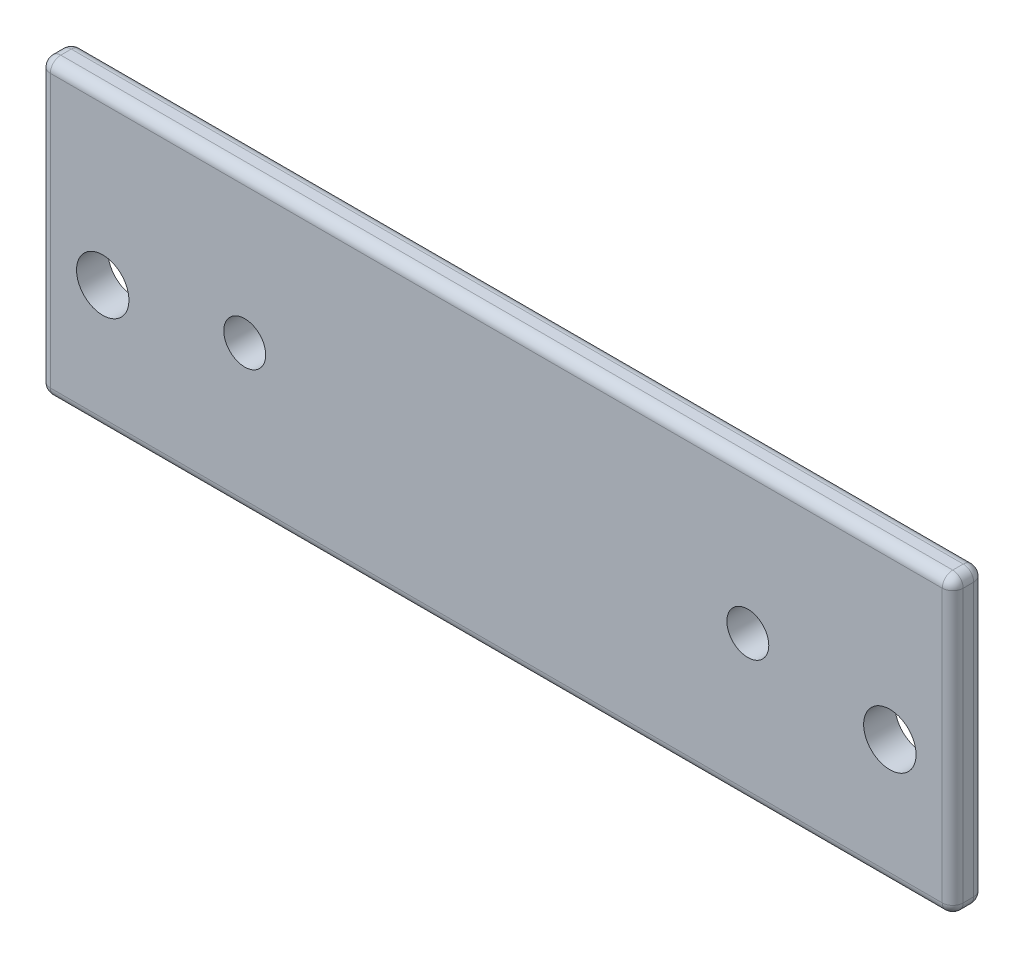
from build123d import *

# Parameters (mm, degrees)
AUFSATZ_LINEAR_AUSTRAGEN1_DEPTH = 3
SKIZZE3_R                       = 2.5
SCHNITT_LINEAR_AUSTRAGEN1_DEPTH = 3
SKIZZE6_R                       = 2
SCHNITT_LINEAR_AUSTRAGEN3_DEPTH = 3
FILLET1_R                       = 1


with BuildPart() as part:
    # Skizze1 → Aufsatz-Linear austragen1 (new body)
    with BuildSketch(Plane.XY):
        Polygon((-37.552187815, 28), (-43.552187815, 28), (-43.552187815, 0), (-37.552187815, 0), (37.552187815, 0), (43.552187815, 0), (43.552187815, 28), (37.552187815, 28), align=None)
    extrude(amount=AUFSATZ_LINEAR_AUSTRAGEN1_DEPTH)

    # Skizze3 → Schnitt-Linear austragen1 (cut)
    with BuildSketch(Plane.XY.offset(3)):
        with Locations((-37.552187815, 12)):
            Circle(SKIZZE3_R)
        with Locations((37.552187815, 12)):
            Circle(SKIZZE3_R)
    extrude(amount=-SCHNITT_LINEAR_AUSTRAGEN1_DEPTH, mode=Mode.SUBTRACT)

    # Skizze6 → Schnitt-Linear austragen3 (cut)
    with BuildSketch(Plane.XY.offset(3)):
        with Locations((-24, 14)):
            Circle(SKIZZE6_R)
        with Locations((24, 14)):
            Circle(SKIZZE6_R)
    extrude(amount=-SCHNITT_LINEAR_AUSTRAGEN3_DEPTH, mode=Mode.SUBTRACT)

    # Fillet1
    fillet1_edges = [part.edges().sort_by_distance(p)[0] for p in [
        (-43.552187815, 14, 0),
        (-43.552187815, 14, 3),
        (43.552187815, 28, 1.5),
        (43.552187815, 0, 1.5),
        (-43.552187815, 0, 1.5),
        (-43.552187815, 28, 1.5),
        (0, 0, 3),
        (43.552187815, 14, 3),
        (0, 28, 3),
        (0, 28, 0),
        (43.552187815, 14, 0),
        (0, 0, 0),
    ]]
    fillet(fillet1_edges, radius=FILLET1_R)


solid = part.part
